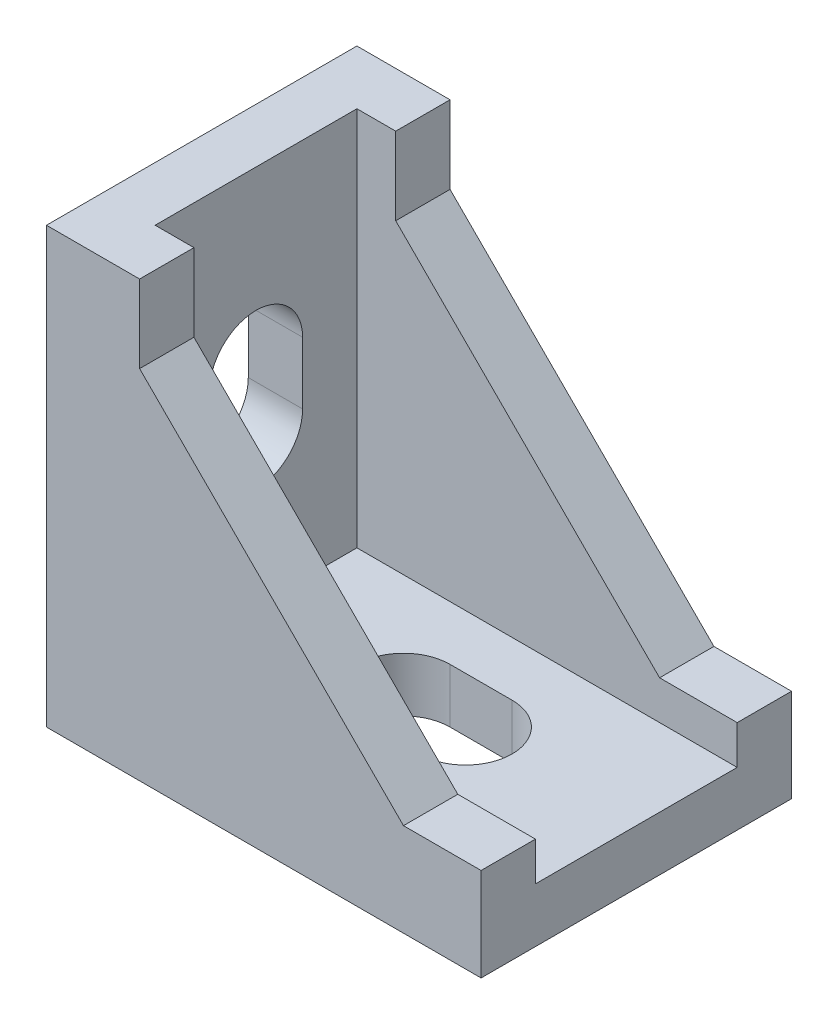
from build123d import *

# Parameters (mm, degrees)
BOSS_EXTRUDE1_DEPTH = 10
BOSS_EXTRUDE2_DEPTH = 3.5
CUT_EXTRUDE1_REACH  = 40.526
CUT_EXTRUDE2_REACH  = 40.526


with BuildPart() as part:
    # Sketch1 → Boss-Extrude1 (new, symmetric)
    with BuildSketch(Plane.XY):
        Polygon((0, 28), (0, 0), (28, 0), (28, 3.5), (3.5, 3.5), (3.5, 28), align=None)
    extrude(amount=BOSS_EXTRUDE1_DEPTH, both=True)

    # Sketch2 → Boss-Extrude2 (add)
    with BuildSketch(Plane.XY.offset(10)):
        Polygon((3.5, 28), (6, 28), (6, 23), (23, 6), (28, 6), (28, 3.5), (3.5, 3.5), align=None)
    boss_extrude2 = extrude(amount=-BOSS_EXTRUDE2_DEPTH)

    # Mirror1: Boss-Extrude2 across plane
    add(boss_extrude2.mirror(Plane.XY))

    # Sketch3 → Cut-Extrude1 (cut, up to next)
    with BuildSketch(Plane(origin=(0, 3.5, 0), x_dir=(1, 0, 0), z_dir=(0, 1, 0)), mode=Mode.PRIVATE) as cut_extrude1_sk1:
        with BuildLine():
            Line((13, 3), (17, 3))
            ThreePointArc((17, 3), (20, 0), (17, -3))
            Line((17, -3), (13, -3))
            ThreePointArc((13, -3), (10, 0), (13, 3))
        make_face()
    cut_extrude1_tool1 = extrude(cut_extrude1_sk1.sketch, amount=-CUT_EXTRUDE1_REACH, mode=Mode.PRIVATE) & part.part
    add(cut_extrude1_tool1.solids().sort_by_distance((15, 3.5, 0))[0], mode=Mode.SUBTRACT)

    # Sketch4 → Cut-Extrude2 (cut, up to next)
    with BuildSketch(Plane(origin=(3.5, 0, 0), x_dir=(0, 0, -1), z_dir=(1, 0, 0)), mode=Mode.PRIVATE) as cut_extrude2_sk1:
        with BuildLine():
            Line((-3, 13), (-3, 17))
            ThreePointArc((-3, 17), (0, 20), (3, 17))
            Line((3, 17), (3, 13))
            ThreePointArc((3, 13), (0, 10), (-3, 13))
        make_face()
    cut_extrude2_tool1 = extrude(cut_extrude2_sk1.sketch, amount=-CUT_EXTRUDE2_REACH, mode=Mode.PRIVATE) & part.part
    add(cut_extrude2_tool1.solids().sort_by_distance((3.5, 15, 0))[0], mode=Mode.SUBTRACT)


solid = part.part
